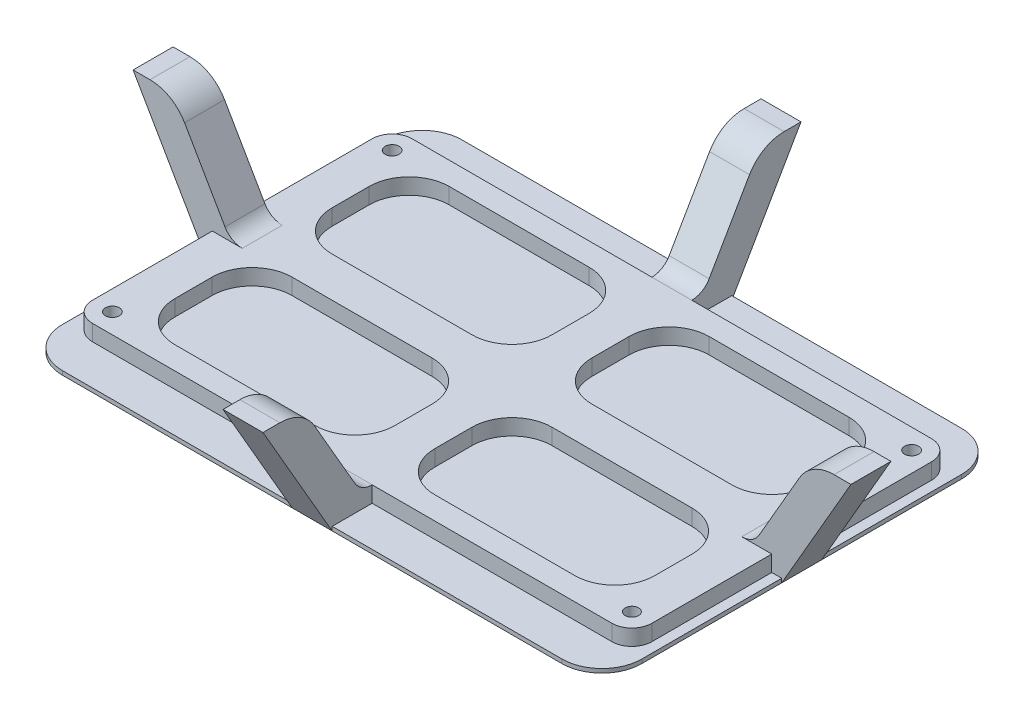
from build123d import *

# Parameters (mm, degrees)
SKETCH_1_W           = 145
SKETCH_1_H           = 100
EXTRUDE_1_DEPTH      = 1
SKETCH_2_W           = 55.047445891
SKETCH_2_H           = 29.312826224
EXTRUDE_2_DEPTH      = 4
SKETCH_3_R           = 1.75
SKETCH_3_R_2         = 1.682307007
CUT_EXTRUDE_1_DEPTH  = 89.211393822
EXTRUDE_3_DEPTH      = 5
EXTRUDE_3_DEPTH_BACK = 5
EXTRUDE_4_DEPTH      = 5
EXTRUDE_4_DEPTH_BACK = 5
FILLET_1_R           = 10
FILLET_3_R           = 10
FILLET_4_R           = 5
FILLET_5_R           = 10


with BuildPart() as part:
    # Эскиз1 → Бобышка-Вытянуть1 (new body)
    with BuildSketch(Plane(origin=(0, 0, 0), x_dir=(1, 0, 0), z_dir=(0, 1, 0))):
        Rectangle(SKETCH_1_W, SKETCH_1_H)
    extrude(amount=EXTRUDE_1_DEPTH)

    # Эскиз2 → Бобышка-Вытянуть2 (add)
    with BuildSketch(Plane(origin=(0, 1, 0), x_dir=(1, 0, 0), z_dir=(0, 1, 0))):
        with BuildLine():
            Line((70, -35), (70, 35))
            ThreePointArc((70, 35), (68.535533919, 38.535533893), (65.000000038, 40))
            Line((65.000000038, 40), (5, 40))
            Line((5, 40), (5, 50))
            Line((5, 50), (-5, 50))
            Line((-5, 50), (-5, 40))
            Line((-5, 40), (-65, 40))
            ThreePointArc((-65, 40), (-68.535533906, 38.535533906), (-70, 35))
            Line((-70, 35), (-70, -35))
            ThreePointArc((-70, -35), (-68.535533906, -38.535533906), (-65, -40))
            Line((-65, -40), (-5, -40))
            Line((-5, -40), (-5, -50))
            Line((-5, -50), (5, -50))
            Line((5, -50), (5, -40))
            Line((5, -40), (64.999999981, -40))
            ThreePointArc((64.999999981, -40), (68.535533899, -38.535533913), (70, -35))
        make_face()
        with Locations((-32.523722945, -19.656413112)):
            Rectangle(SKETCH_2_W, SKETCH_2_H, mode=Mode.SUBTRACT)
        with Locations((32.523722945, -19.656413112)):
            Rectangle(SKETCH_2_W, SKETCH_2_H, mode=Mode.SUBTRACT)
        with Locations((-32.523722945, 19.656413112)):
            Rectangle(SKETCH_2_W, SKETCH_2_H, mode=Mode.SUBTRACT)
        with Locations((32.523722945, 19.656413112)):
            Rectangle(SKETCH_2_W, SKETCH_2_H, mode=Mode.SUBTRACT)
    extrude(amount=EXTRUDE_2_DEPTH)

    # Эскиз3 → Вырез-Вытянуть1 (cut, through all)
    with BuildSketch(Plane(origin=(0, 5, 0), x_dir=(1, 0, 0), z_dir=(0, 1, 0))):
        with Locations(Location((-65, 35, 0), (0, 0, 270))):
            Circle(SKETCH_3_R)
        with Locations(Location((-65, -35, 0), (0, 0, 270))):
            Circle(SKETCH_3_R)
        with Locations(Location((65, -35, 0), (0, 0, 270))):
            Circle(SKETCH_3_R_2)
        with Locations(Location((65, 35, 0), (0, 0, 270))):
            Circle(SKETCH_3_R)
    extrude(amount=-CUT_EXTRUDE_1_DEPTH, mode=Mode.SUBTRACT)

    # Эскиз4 → Бобышка-Вытянуть3 (add, two sides: drawn at the far end of the back side and taken through both)
    with BuildSketch(Plane.XY.offset(-EXTRUDE_3_DEPTH_BACK)):
        Polygon((-72.5, 0), (-62.5, 0), (-63.077350269, 1), (-70, 1), (-70, 5), (-65.386751346, 5), (-79.820508076, 30), (-89.820508076, 30), align=None)
        Polygon((79.820508076, 30), (62.5, 0), (72.5, 0), (89.820508076, 30), align=None)
    extrude(amount=EXTRUDE_3_DEPTH + EXTRUDE_3_DEPTH_BACK)

    # Эскиз5 → Бобышка-Вытянуть4 (add, two sides: drawn at the far end of the back side and taken through both)
    with BuildSketch(Plane(origin=(0, 0, 0), x_dir=(0, 0, -1), z_dir=(1, 0, 0)).offset(-EXTRUDE_4_DEPTH_BACK)):
        Polygon((-50, 1), (-40.577350269, 1), (-57.320508076, 30), (-67.320508076, 30), (-50, 0), align=None)
        Polygon((50, 0), (40, 0), (57.320508076, 30), (67.320508076, 30), align=None)
    extrude(amount=EXTRUDE_4_DEPTH + EXTRUDE_4_DEPTH_BACK)

    # Скругление1
    fillet_1_edges = [part.edges().sort_by_distance(p)[0] for p in [
        (72.5, 0.5, 50),
        (-72.5, 0.5, 50),
        (-72.5, 0.5, -50),
        (72.5, 0.5, -50),
    ]]
    fillet(fillet_1_edges, radius=FILLET_1_R)

    # Скругление3
    fillet_3_edges = [part.edges().sort_by_distance(p)[0] for p in [
        (5, 3, -34.312826224),
        (60.047445891, 3, -34.312826224),
        (60.047445891, 3, 5),
        (60.047445891, 3, 34.312826224),
        (-5, 3, 5),
        (-60.047445891, 3, 5),
        (-5, 3, 34.312826224),
        (-60.047445891, 3, 34.312826224),
        (-60.047445891, 3, -5),
        (-60.047445891, 3, -34.312826224),
        (5, 3, -5),
        (60.047445891, 3, -5),
        (-5, 3, -34.312826224),
        (-5, 3, -5),
        (5, 3, 34.312826224),
        (5, 3, 5),
    ]]
    fillet(fillet_3_edges, radius=FILLET_3_R)

    # Скругление4
    fillet_4_edges = [part.edges().sort_by_distance(p)[0] for p in [
        (0, 5, 42.886751346),
        (-65.386751346, 5, 0),
        (65.386751346, 5, 0),
        (0, 5, -42.886751346),
    ]]
    fillet(fillet_4_edges, radius=FILLET_4_R)

    # Скругление5
    fillet_5_edges = [part.edges().sort_by_distance(p)[0] for p in [
        (-79.820508076, 30, 0),
        (79.820508076, 30, 0),
        (0, 30, 57.320508076),
        (0, 30, -57.320508076),
    ]]
    fillet(fillet_5_edges, radius=FILLET_5_R)


solid = part.part
